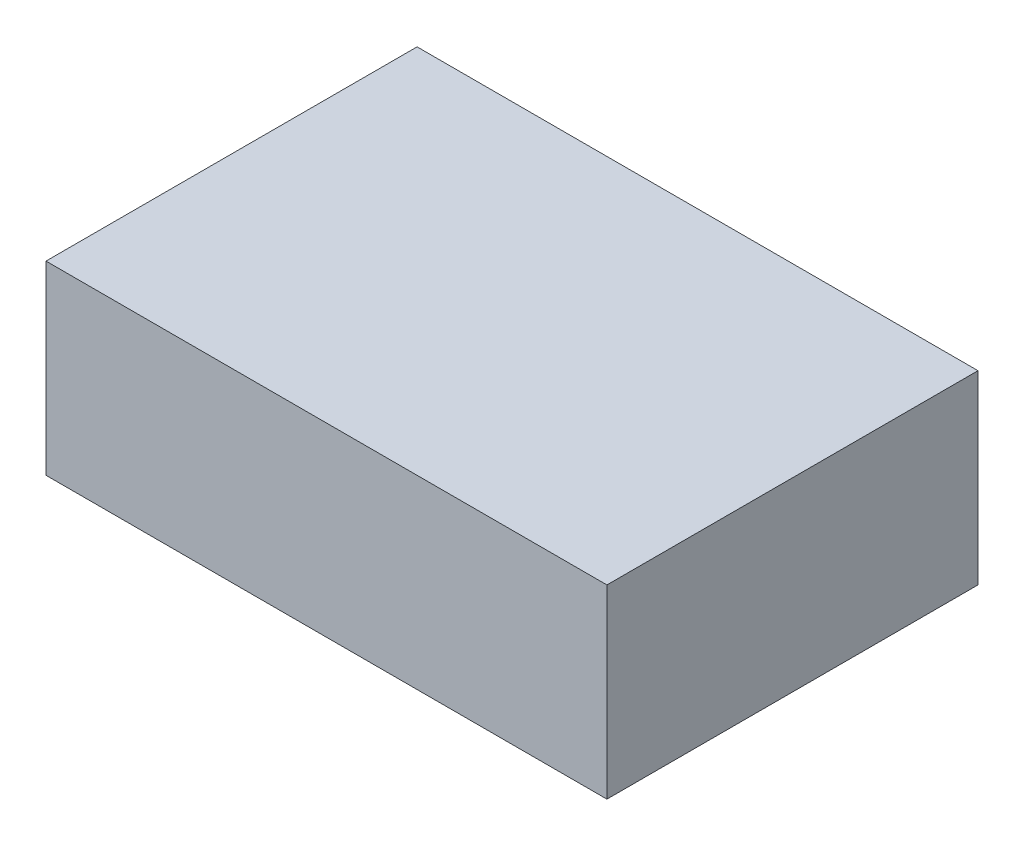
from build123d import *

# Parameters (mm, degrees)
SKETCH1_W                 = 130.000000096
SKETCH1_H                 = 43.000000106
BOSS_EXTRUDE1_DEPTH       = 42.999999979
M3X0_5_TAPPED_HOLE1_D     = 2.5
M3X0_5_TAPPED_HOLE1_DEPTH = 1.999996
M3X0_5_TAPPED_HOLE1_TIP   = 0.751075774
SKETCH4_R                 = 12.7
CUT_EXTRUDE1_DEPTH        = 2.54


with BuildPart() as part:
    # Sketch1 → Boss-Extrude1 (new, symmetric)
    with BuildSketch(Plane.XY):
        Rectangle(SKETCH1_W, SKETCH1_H)
    extrude(amount=BOSS_EXTRUDE1_DEPTH, both=True)

    # M3x0.5 Tapped Hole1
    with Locations(Plane(origin=(0, -21.500000053, 0), x_dir=(-1, 0, 0), z_dir=(0, -1, 0))):
        with Locations((60.000000142, -24.700000003), (-60.000000142, -24.700000003), (-60.000000142, 25.300000073), (60.000000142, 25.300000073)):
            Hole(M3X0_5_TAPPED_HOLE1_D / 2, depth=M3X0_5_TAPPED_HOLE1_DEPTH)
            with Locations((0, 0, -(M3X0_5_TAPPED_HOLE1_DEPTH + M3X0_5_TAPPED_HOLE1_TIP / 2))):  # 118° drill point
                Cone(0, M3X0_5_TAPPED_HOLE1_D / 2, M3X0_5_TAPPED_HOLE1_TIP, mode=Mode.SUBTRACT)

    # Sketch4 → Cut-Extrude1 (cut)
    with BuildSketch(Plane(origin=(0, 0, -42.999999979), x_dir=(-1, 0, 0), z_dir=(0, 0, -1))):
        Circle(SKETCH4_R)
    extrude(amount=-CUT_EXTRUDE1_DEPTH, mode=Mode.SUBTRACT)


solid = part.part
